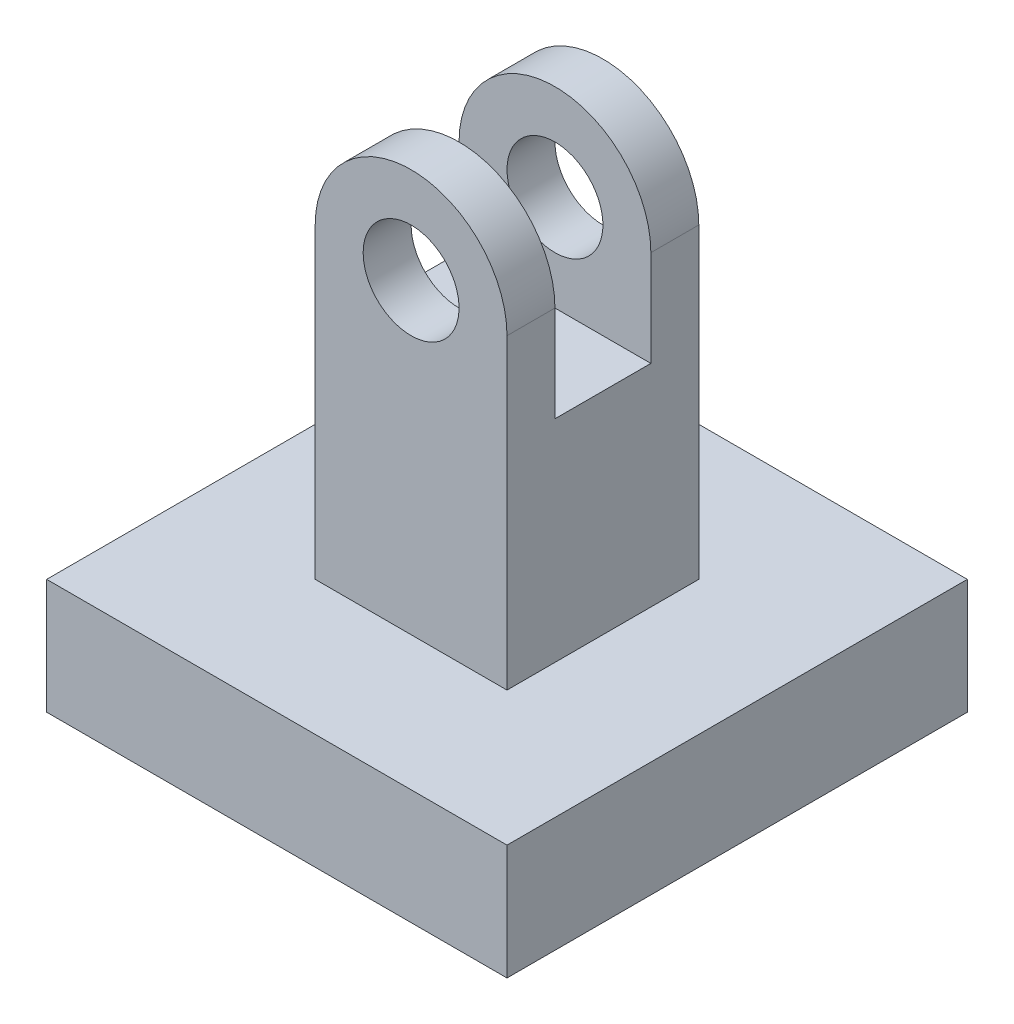
from build123d import *

# Parameters (mm, degrees)
SKETCH_1_W               = 60
SKETCH_1_H               = 60
EXTRUDE_1_DEPTH          = 15
EXTRUDE_START            = 15
SKETCH_2_W               = 25
SKETCH_2_H               = 25
EXTRUDE_2_DEPTH          = 40
EXTRUDE_START_2          = 12.5
EXTRUDE_3_DEPTH          = 25
CUT_EXTRUDE_START        = -12.5
SKETCH_8_R               = 6.25
CUT_EXTRUDE_5_DEPTH      = 25
CUT_EXTRUDE_6_DEPTH      = 6.25
CUT_EXTRUDE_6_DEPTH_BACK = 6.25
SKETCH_9_W               = 25
SKETCH_9_H               = 25


with BuildPart() as part:
    # 草图1 → 凸台-拉伸1 (new body)
    with BuildSketch(Plane(origin=(0, 0, 0), x_dir=(1, 0, 0), z_dir=(0, 1, 0))):
        Rectangle(SKETCH_1_W, SKETCH_1_H)
    extrude(amount=EXTRUDE_1_DEPTH)

    # 草图2 → 凸台-拉伸2 (add)
    with BuildSketch(Plane(origin=(0, 0, 0), x_dir=(1, 0, 0), z_dir=(0, 1, 0)).offset(EXTRUDE_START)):
        Rectangle(SKETCH_2_W, SKETCH_2_H)
    extrude(amount=EXTRUDE_2_DEPTH)

    # 草图6 → 凸台-拉伸3 (add)
    with BuildSketch(Plane.XY.offset(EXTRUDE_START_2)):
        with BuildLine():
            Line((-12.5, 55), (12.5, 55))
            ThreePointArc((12.5, 55), (0, 67.5), (-12.5, 55))
        make_face()
    extrude(amount=-EXTRUDE_3_DEPTH)

    # 草图8 → 切除-拉伸5 (cut)
    with BuildSketch(Plane.XY.offset(CUT_EXTRUDE_START)):
        with Locations(Location((0, 55, 0), (0, 0, 180))):
            Circle(SKETCH_8_R)
    extrude(amount=CUT_EXTRUDE_5_DEPTH, mode=Mode.SUBTRACT)

    # 草图9 → 切除-拉伸6 (cut, two sides: drawn at the far end of the back side and taken through both)
    with BuildSketch(Plane.XY.offset(-CUT_EXTRUDE_6_DEPTH_BACK)):
        with Locations((0, 55)):
            Rectangle(SKETCH_9_W, SKETCH_9_H)
    extrude(amount=CUT_EXTRUDE_6_DEPTH + CUT_EXTRUDE_6_DEPTH_BACK, mode=Mode.SUBTRACT)


solid = part.part
